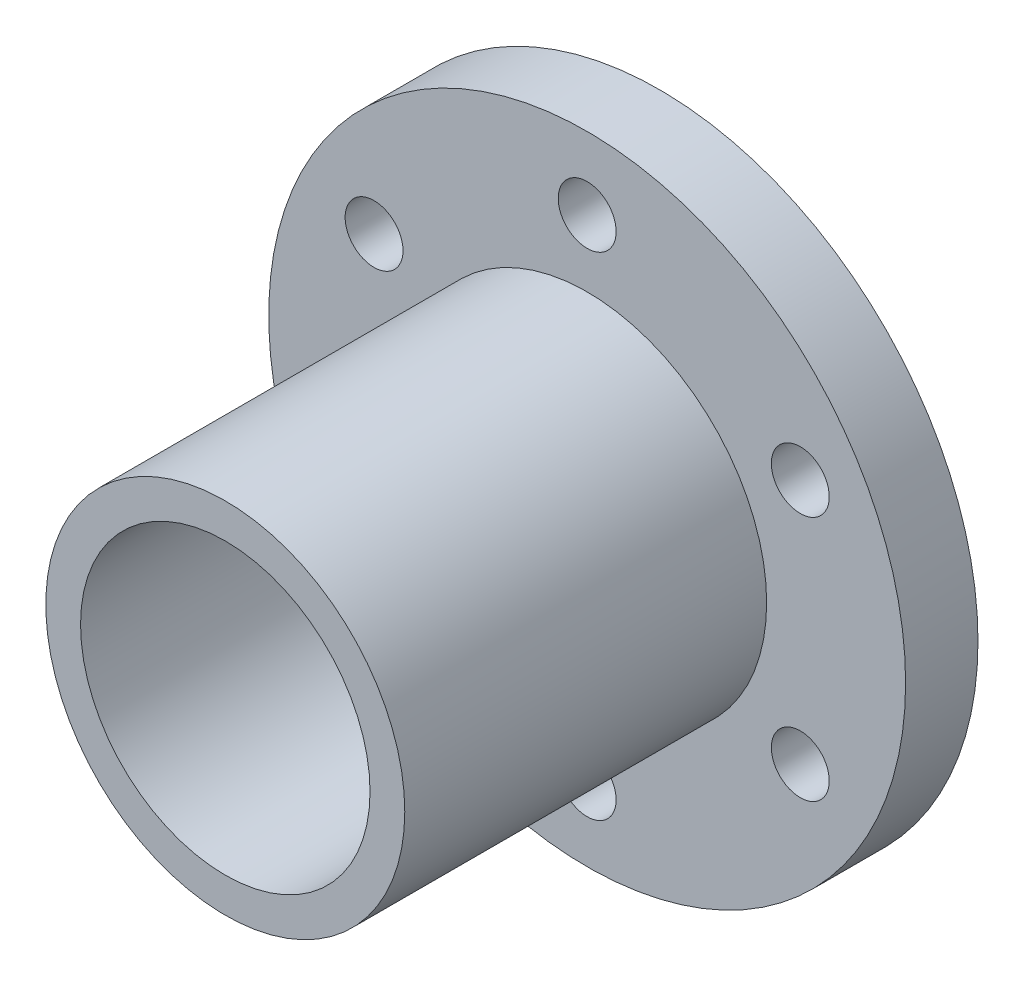
from build123d import *

# Parameters (mm, degrees)
SKETCH1_R           = 110
BOSS_EXTRUDE1_DEPTH = 25
SKETCH2_R           = 62
BOSS_EXTRUDE2_DEPTH = 125
SKETCH3_R           = 50
CUT_EXTRUDE1_DEPTH  = 217.10182785
SKETCH4_R           = 10
CUT_EXTRUDE2_DEPTH  = 200.562020435


with BuildPart() as part:
    # Sketch1 → Boss-Extrude1 (new body)
    with BuildSketch(Plane.XY):
        Circle(SKETCH1_R)
    extrude(amount=BOSS_EXTRUDE1_DEPTH)

    # Sketch2 → Boss-Extrude2 (add)
    with BuildSketch(Plane.XY.offset(25)):
        Circle(SKETCH2_R)
    extrude(amount=BOSS_EXTRUDE2_DEPTH)

    # Sketch3 → Cut-Extrude1 (cut, through all)
    with BuildSketch(Plane.XY.offset(150)):
        Circle(SKETCH3_R)
    extrude(amount=-CUT_EXTRUDE1_DEPTH, mode=Mode.SUBTRACT)

    # Sketch4 → Cut-Extrude2 (cut, through all)
    with BuildSketch(Plane.XY.offset(25)):
        with Locations((0, 85)):
            Circle(SKETCH4_R)
        with Locations((73.612159322, 42.5)):
            Circle(SKETCH4_R)
        with Locations((73.612159322, -42.5)):
            Circle(SKETCH4_R)
        with Locations((0, -85)):
            Circle(SKETCH4_R)
        with Locations((-73.612159322, -42.5)):
            Circle(SKETCH4_R)
        with Locations((-73.612159322, 42.5)):
            Circle(SKETCH4_R)
    extrude(amount=-CUT_EXTRUDE2_DEPTH, mode=Mode.SUBTRACT)


solid = part.part
